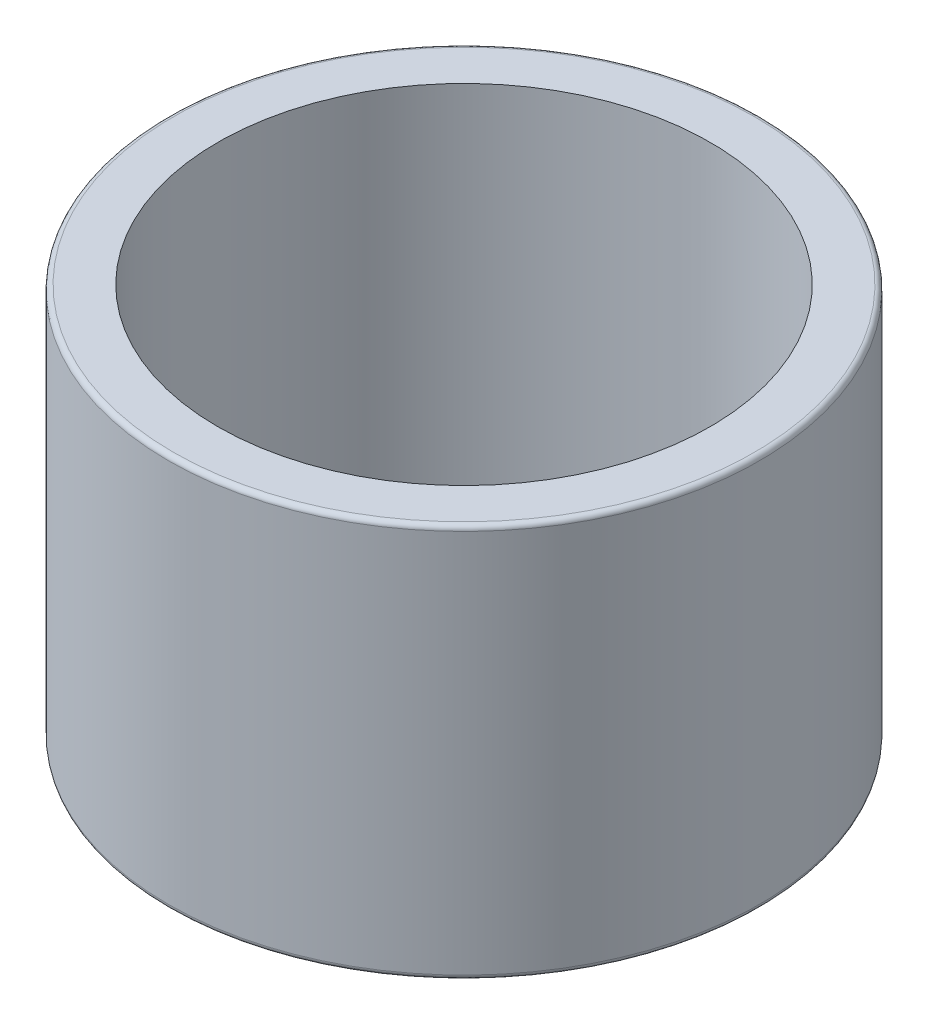
from build123d import *

# Parameters (mm, degrees)
SKIZZE1_R                       = 6
SKIZZE1_R_2                     = 5
AUFSATZ_LINEAR_AUSTRAGEN1_DEPTH = 4
VERRUNDUNG1_R                   = 0.1


with BuildPart() as part:
    # Skizze1 → Aufsatz-Linear austragen1 (new, symmetric)
    with BuildSketch(Plane(origin=(0, 0, 0), x_dir=(1, 0, 0), z_dir=(0, 1, 0))):
        with Locations(Location((0, 0, 0), (0, 0, 270))):
            Circle(SKIZZE1_R)
        with Locations(Location((0, 0, 0), (0, 0, 270))):
            Circle(SKIZZE1_R_2, mode=Mode.SUBTRACT)
    extrude(amount=AUFSATZ_LINEAR_AUSTRAGEN1_DEPTH, both=True)

    # Verrundung1
    verrundung1_edges = [part.edges().sort_by_distance(p)[0] for p in [
        (0, -4, -6),
        (0, 4, -6),
    ]]
    fillet(verrundung1_edges, radius=VERRUNDUNG1_R)


solid = part.part
